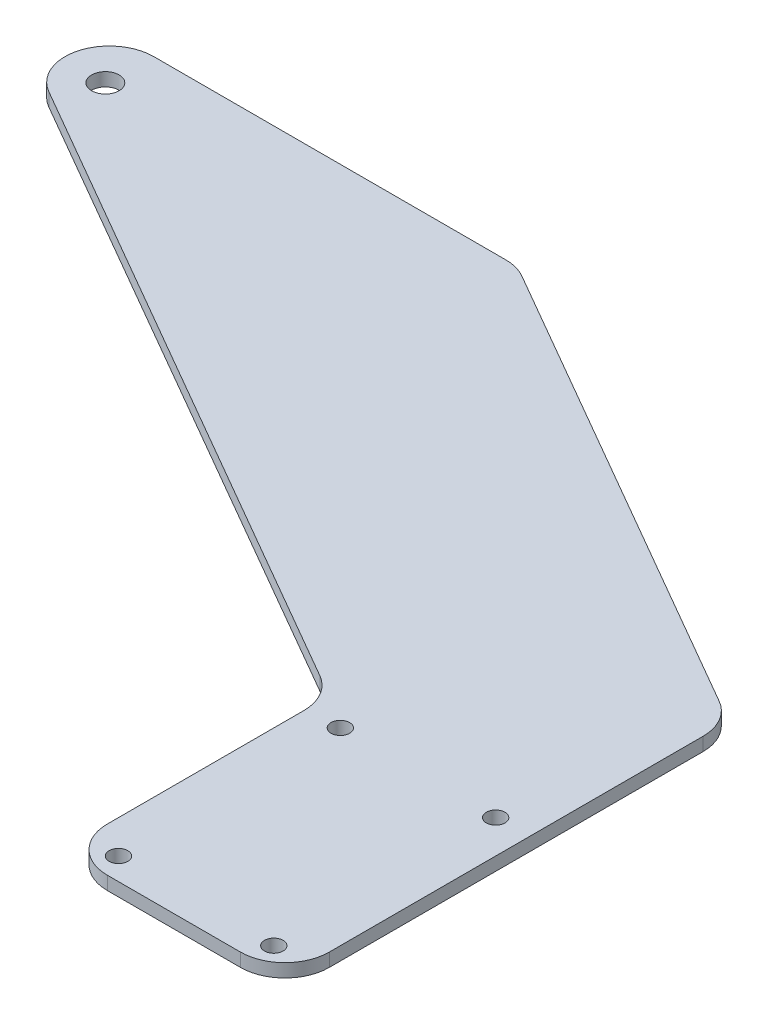
from build123d import *

# Parameters (mm, degrees)
SKETCH_1_R          = 2.1
EXTRUDE_1_DEPTH     = 3
FILLET_1_R          = 10
SKETCH_2_R          = 3.1
CUT_EXTRUDE_1_DEPTH = 10
FILLET_2_R          = 10


with BuildPart() as part:
    # 草图1 → 凸台-拉伸1 (new body)
    with BuildSketch(Plane(origin=(0, 0, 0), x_dir=(1, 0, 0), z_dir=(0, 1, 0))):
        Polygon((-7.5, 55), (-7.5, -5), (42.5, -5), (42.5, 55), (42.5, 95), (12.189110868, 112.5), (-18.121778265, 130), (-70.083302492, 160), (-154.724318643, 160), (-189.365334795, 160), align=None)
        with Locations(Location((0, 0, 0), (0, 0, 270))):
            Circle(SKETCH_1_R, mode=Mode.SUBTRACT)
        with Locations(Location((35, 0, 0), (0, 0, 270))):
            Circle(SKETCH_1_R, mode=Mode.SUBTRACT)
        with Locations(Location((0, 50, 0), (0, 0, 270))):
            Circle(SKETCH_1_R, mode=Mode.SUBTRACT)
        with Locations(Location((35, 50, 0), (0, 0, 270))):
            Circle(SKETCH_1_R, mode=Mode.SUBTRACT)
    extrude(amount=EXTRUDE_1_DEPTH)

    # 圆角1
    fillet_1_edges = [part.edges().sort_by_distance(p)[0] for p in [
        (-70.083302492, 1.5, -160),
        (42.5, 1.5, -95),
        (-7.5, 1.5, -55),
        (-189.365334795, 1.5, -160),
    ]]
    fillet(fillet_1_edges, radius=FILLET_1_R)

    # 草图2 → 切除-拉伸1 (cut)
    with BuildSketch(Plane(origin=(0, 3, 0), x_dir=(1, 0, 0), z_dir=(0, 1, 0))):
        with Locations(Location((-152.37976321, 149.419872981, 0), (0, 0, 270))):
            Circle(SKETCH_2_R)
    extrude(amount=-CUT_EXTRUDE_1_DEPTH, mode=Mode.SUBTRACT)

    # 圆角2
    fillet_2_edges = [part.edges().sort_by_distance(p)[0] for p in [
        (42.5, 1.5, 5),
        (-7.5, 1.5, 5),
    ]]
    fillet(fillet_2_edges, radius=FILLET_2_R)


solid = part.part
